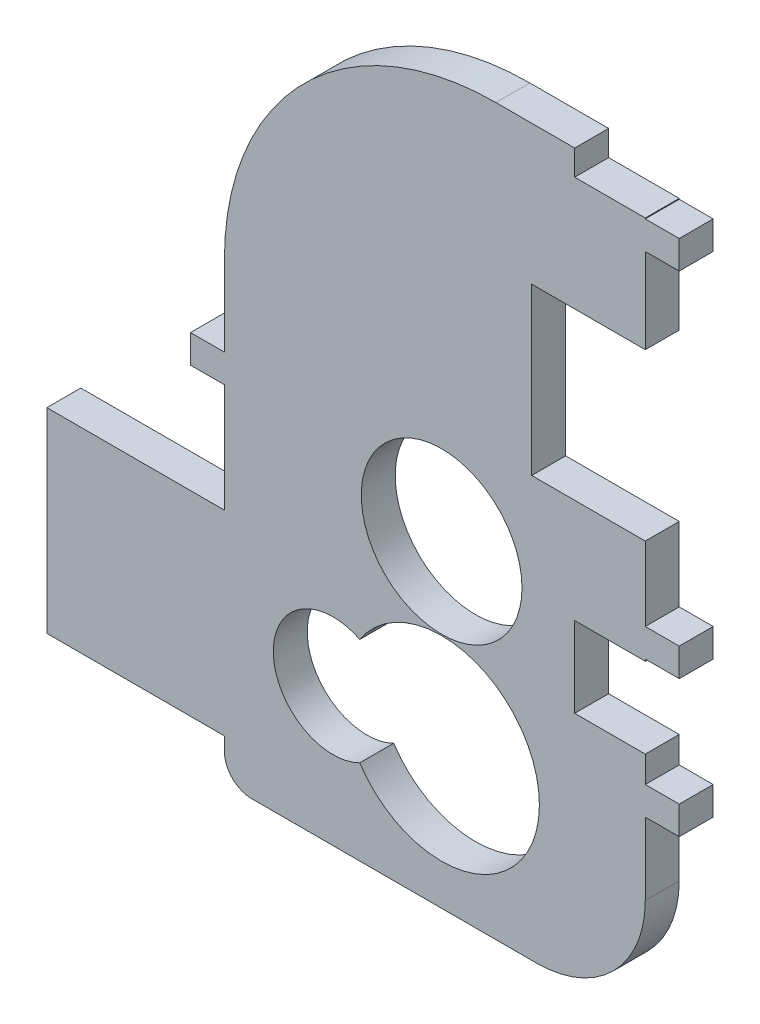
from build123d import *

# Parameters (mm, degrees)
SKETCH1_R           = 3.7592
BOSS_EXTRUDE1_DEPTH = 1.5875
CUT_EXTRUDE1_REACH  = 28.578
SKETCH2_W           = 3.302
SKETCH2_H           = 3.7592
CUT_EXTRUDE2_REACH  = 28.578
SKETCH3_W           = 8.3
SKETCH3_H           = 7.75
FILLET1_R           = 5.08
FILLET2_R           = 1.27


with BuildPart() as part:
    # Sketch1 → Boss-Extrude1 (new body)
    with BuildSketch(Plane.XY):
        with BuildLine():
            Line((11.1125, 17.8308), (9.525, 17.8308))
            Line((9.525, 17.8308), (9.525, 19.05))
            Line((9.525, 19.05), (2.54, 19.05))
            ThreePointArc((2.54, 19.05), (-6.440256121, 15.330256121), (-10.16, 6.35))
            Line((-10.16, 6.35), (-10.16, 2.5908))
            Line((-10.16, 2.5908), (-11.7475, 2.5908))
            Line((-11.7475, 2.5908), (-11.7475, 1.27))
            Line((-11.7475, 1.27), (-10.16, 1.27))
            Line((-10.16, 1.27), (-10.16, -3.81))
            Line((-10.16, -3.81), (-18.4658, -3.81))
            Line((-18.4658, -3.81), (-18.4658, -12.954))
            Line((-18.4658, -12.954), (-10.16, -12.954))
            Line((-10.16, -12.954), (-10.16, -14.859))
            Line((-10.16, -14.859), (9.525, -14.859))
            Line((9.525, -14.859), (9.525, -6.4008))
            Line((9.525, -6.4008), (11.1125, -6.4008))
            Line((11.1125, -6.4008), (11.1125, -5.08))
            Line((11.1125, -5.08), (9.525, -5.08))
            Line((9.525, -5.08), (9.525, 0))
            Line((9.525, 0), (11.1125, 0))
            Line((11.1125, 0), (11.1125, 1.3208))
            Line((11.1125, 1.3208), (9.525, 1.3208))
            Line((9.525, 1.3208), (9.525, 16.51))
            Line((9.525, 16.51), (11.1125, 16.51))
            Line((11.1125, 16.51), (11.1125, 17.8308))
        make_face()
        Circle(SKETCH1_R, mode=Mode.SUBTRACT)
        with BuildLine():
            ThreePointArc((-3.82905, -5.883688551), (4.572, -8.382), (-3.82905, -10.880311449))
            ThreePointArc((-3.82905, -10.880311449), (-7.874, -8.382), (-3.82905, -5.883688551))
        make_face(mode=Mode.SUBTRACT)
    extrude(amount=BOSS_EXTRUDE1_DEPTH)

    # Sketch2 → Cut-Extrude1 (cut, up to next)
    with BuildSketch(Plane.XY.offset(1.5875), mode=Mode.PRIVATE) as cut_extrude1_sk1:
        with Locations((7.874, -1.9685)):
            Rectangle(SKETCH2_W, SKETCH2_H)
    cut_extrude1_tool1 = extrude(cut_extrude1_sk1.sketch, amount=-CUT_EXTRUDE1_REACH, mode=Mode.PRIVATE) & part.part
    # Sketch2 → Cut-Extrude1 (cut, up to next)
    with BuildSketch(Plane.XY.offset(1.5875), mode=Mode.PRIVATE) as cut_extrude1_sk2:
        with Locations((7.874, 19.7485)):
            Rectangle(SKETCH2_W, SKETCH2_H)
    cut_extrude1_tool2 = extrude(cut_extrude1_sk2.sketch, amount=-CUT_EXTRUDE1_REACH, mode=Mode.PRIVATE) & part.part
    add(cut_extrude1_tool1.solids().sort_by_distance((7.874, -1.9685, 1.5875))[0], mode=Mode.SUBTRACT)
    add(cut_extrude1_tool2.solids().sort_by_distance((7.874, 19.7485, 1.5875))[0], mode=Mode.SUBTRACT)

    # Sketch3 → Cut-Extrude2 (cut, up to next)
    with BuildSketch(Plane(origin=(0, 0, 0), x_dir=(-1, 0, 0), z_dir=(0, 0, -1)), mode=Mode.PRIVATE) as cut_extrude2_sk1:
        with Locations((-8.3625, 8.656327373)):
            Rectangle(SKETCH3_W, SKETCH3_H)
    cut_extrude2_tool1 = extrude(cut_extrude2_sk1.sketch, amount=-CUT_EXTRUDE2_REACH, mode=Mode.PRIVATE) & part.part
    add(cut_extrude2_tool1.solids().sort_by_distance((8.3625, 8.656327, 0))[0], mode=Mode.SUBTRACT)

    # Fillet1
    fillet1_edges = [part.edges().sort_by_distance(p)[0] for p in [
        (9.525, -14.859, 0.79375),
    ]]
    fillet(fillet1_edges, radius=FILLET1_R)

    # Fillet2
    fillet2_edges = [part.edges().sort_by_distance(p)[0] for p in [
        (-10.16, -14.859, 0.79375),
    ]]
    fillet(fillet2_edges, radius=FILLET2_R)


solid = part.part
